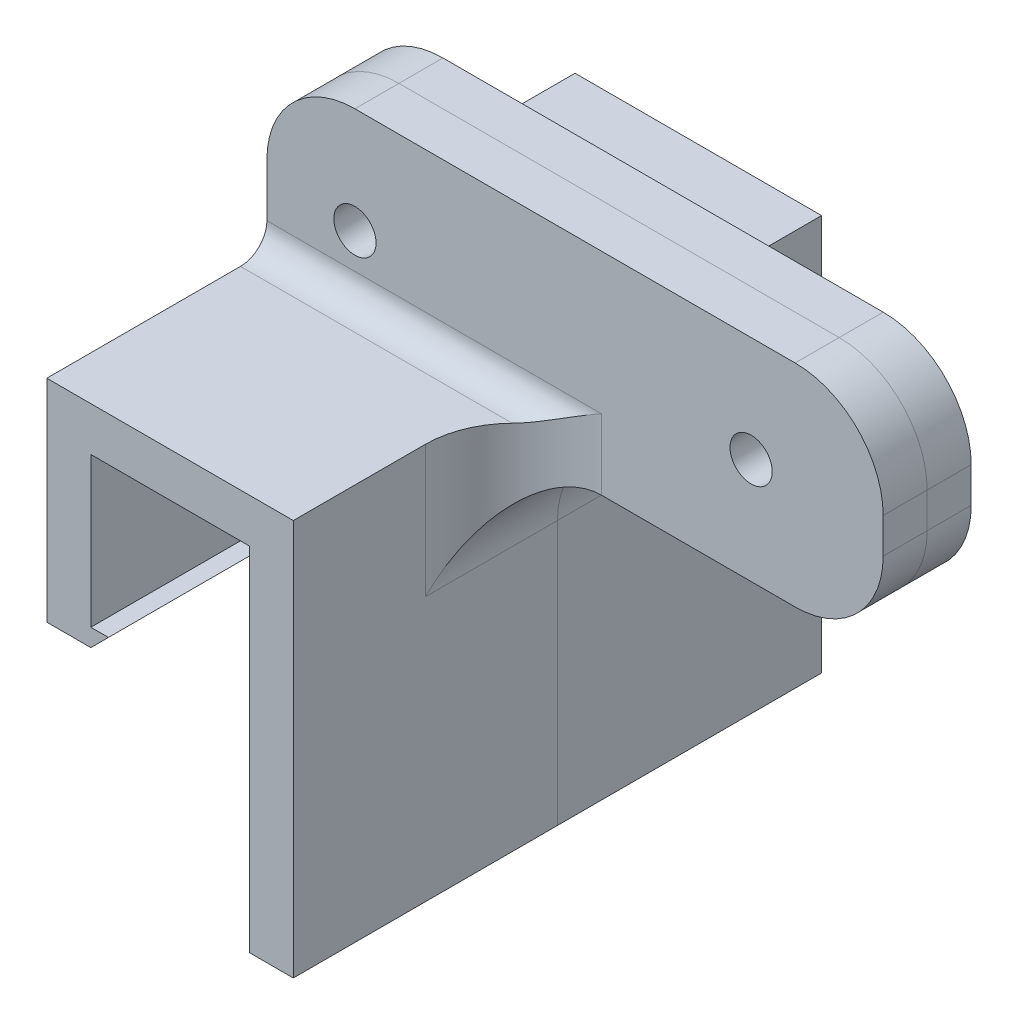
from build123d import *

# Parameters (mm, degrees)
BOSS_EXTRUDE1_DEPTH  = 30
SKETCH2_W            = 70
SKETCH2_H            = 24
BOSS_EXTRUDE2_DEPTH  = 5
M4_CLEARANCE_HOLE1_D = 4.8
FILLET1_R            = 10
FILLET2_R            = 3


with BuildPart() as part:
    # Sketch1 → Boss-Extrude1 (new body)
    with BuildSketch(Plane.XY):
        Polygon((0, 0), (0, 24), (28, 24), (28, -21), (23, -21), (23, 19), (5, 19), (5, 2), (7, 2), (5, 0), align=None)
    extrude(amount=BOSS_EXTRUDE1_DEPTH)

    # Sketch2 → Boss-Extrude2 (add)
    with BuildSketch(Plane(origin=(0, 0, 0), x_dir=(-1, 0, 0), z_dir=(0, 0, -1))):
        with Locations((-35, 31)):
            Rectangle(SKETCH2_W, SKETCH2_H)
    extrude(amount=-BOSS_EXTRUDE2_DEPTH)

    # M4 Clearance Hole1 (through all)
    with Locations(Plane(origin=(0, 0, 0), x_dir=(-1, 0, 0), z_dir=(0, 0, -1))):
        with Locations((-10, 31), (-55, 31)):
            Hole(M4_CLEARANCE_HOLE1_D / 2)

    # Fillet1
    fillet1_edges = [part.edges().sort_by_distance(p)[0] for p in [
        (28, 21.5, 5),
        (0, 43, 2.5),
        (28, 19, 2.5),
        (70, 19, 2.5),
        (70, 43, 2.5),
    ]]
    fillet(fillet1_edges, radius=FILLET1_R)

    # Fillet2
    fillet2_edges = [part.edges().sort_by_distance(p)[0] for p in [
        (19, 24, 5),
    ]]
    fillet(fillet2_edges, radius=FILLET2_R)


with BuildPart() as body_2:
    # Mirror1: mirrored copy
    add(part.part.mirror(Plane(origin=(0, 0, 0), x_dir=(1, 0, 0), z_dir=(0, 0, -1))))


solid = Compound([part.part, body_2.part])
